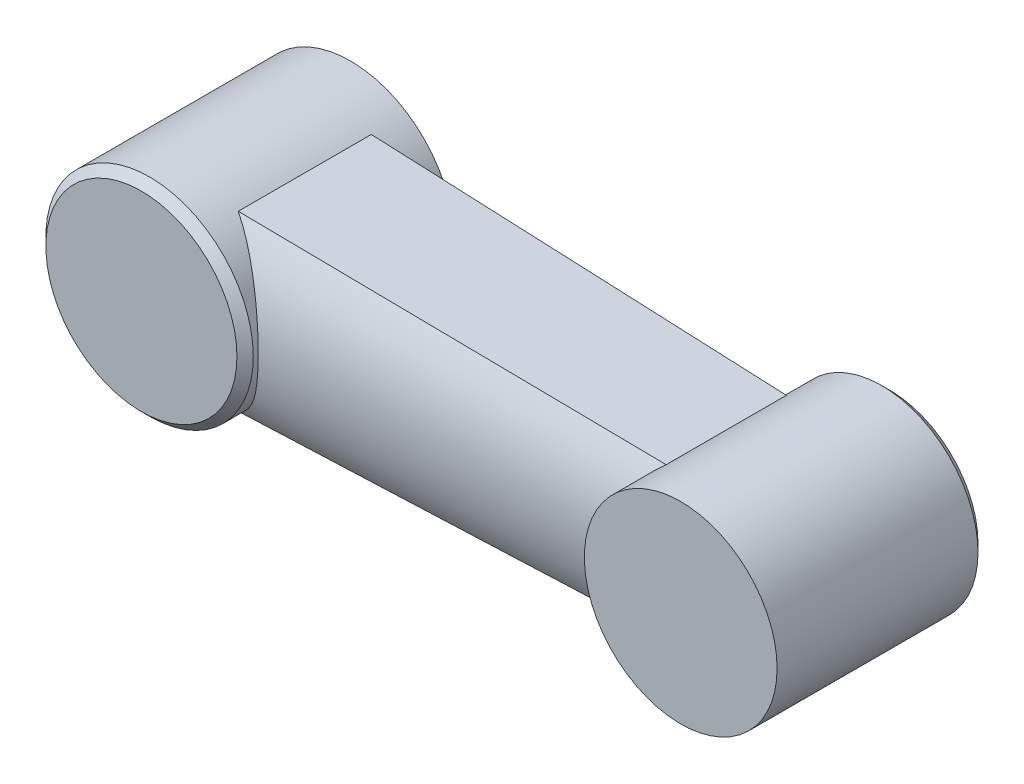
from build123d import *

# Parameters (mm, degrees)
BOSS_EXTRUDE1_DEPTH      = 64
BOSS_EXTRUDE1_DEPTH_BACK = 64
SKETCH1_R                = 63.5
CHAMFER1_SIZE            = 5
BOSS_EXTRUDE2_DEPTH      = 64
BOSS_EXTRUDE2_DEPTH_BACK = 64
SKETCH9_R                = 59
CHAMFER2_SIZE            = 5


with BuildPart() as part:
    # Sketch1 → Boss-Extrude1 (new, two sides: drawn at the far end of the back side and taken through both)
    with BuildSketch(Plane.XY.offset(-BOSS_EXTRUDE1_DEPTH_BACK)):
        Circle(SKETCH1_R)
    extrude(amount=BOSS_EXTRUDE1_DEPTH + BOSS_EXTRUDE1_DEPTH_BACK)

    # Chamfer1
    chamfer1_edges = [part.edges().sort_by_distance(p)[0] for p in [
        (-63.5, 0, 64),
    ]]
    chamfer(chamfer1_edges, length=CHAMFER1_SIZE)

    # Sketch6 for Loft1 → Loft1 section 0
    with BuildSketch(Plane.ZY):
        with BuildLine():
            Line((40.120383673, -54), (-42.379616327, -54))
            # circular arc as an exact rational Bezier (weights 1, cos(half-angle), 1)
            Bezier((-42.379616327, -54), (-75.725192624, 0), (-42.379616327, 54), weights=[1, 0.850849875, 1])
            Line((-42.379616327, 54), (40.120383673, 54))
            Bezier((40.120383673, 54), (79.472033784, 0), (40.120383673, -54), weights=[1, 0.80817386, 1])
        make_face()
    # Sketch7 for Loft1 → Loft1 section 1
    with BuildSketch(Plane(origin=(330.2, 0, 59), x_dir=(0, 0, 1), z_dir=(-1, 0, 0))):
        with BuildLine():
            Line((-23.671140694, -44.884), (-96.137743849, -44.884))
            Bezier((-96.137743849, -44.884), (-120.644145307, 0), (-96.137743849, 44.884), weights=[1, 0.8776964, 1])
            Line((-96.137743849, 44.884), (-23.671140694, 44.884))
            Bezier((-23.671140694, 44.884), (5.395173034, 0), (-23.671140694, -44.884), weights=[1, 0.839367735, 1])
        make_face()
    loft()

    # Sketch9 → Boss-Extrude2 (add, two sides: drawn at the far end of the back side and taken through both)
    with BuildSketch(Plane.XY.offset(-BOSS_EXTRUDE2_DEPTH_BACK)):
        with Locations((330.2, 0)):
            Circle(SKETCH9_R)
    extrude(amount=BOSS_EXTRUDE2_DEPTH + BOSS_EXTRUDE2_DEPTH_BACK)

    # Chamfer2
    chamfer2_edges = [part.edges().sort_by_distance(p)[0] for p in [
        (271.2, 0, -64),
    ]]
    chamfer(chamfer2_edges, length=CHAMFER2_SIZE)


solid = part.part
